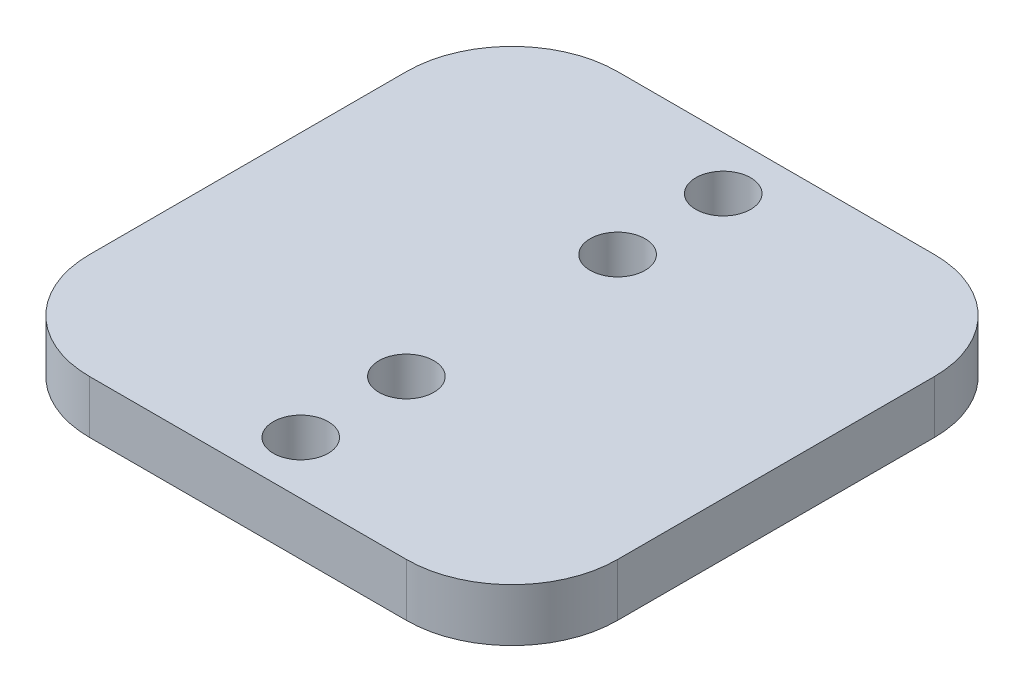
from build123d import *

# Parameters (mm, degrees)
SKETCH1_W           = 50
SKETCH1_H           = 50
BOSS_EXTRUDE1_DEPTH = 5
SKETCH2_R           = 2.6
CUT_EXTRUDE1_DEPTH  = 71.887234394
FILLET1_R           = 10


with BuildPart() as part:
    # Sketch1 → Boss-Extrude1 (new body)
    with BuildSketch(Plane(origin=(0, 0, 0), x_dir=(1, 0, 0), z_dir=(0, 1, 0))):
        with Locations((25, 25)):
            Rectangle(SKETCH1_W, SKETCH1_H)
    extrude(amount=BOSS_EXTRUDE1_DEPTH)

    # Sketch2 → Cut-Extrude1 (cut, through all)
    with BuildSketch(Plane(origin=(0, 5, 0), x_dir=(1, 0, 0), z_dir=(0, 1, 0))):
        with Locations(Location((25, 35, 0), (0, 0, 270))):
            Circle(SKETCH2_R)
        with Locations(Location((25, 45, 0), (0, 0, 270))):
            Circle(SKETCH2_R)
        with Locations(Location((25, 15, 0), (0, 0, 90))):
            Circle(SKETCH2_R)
        with Locations(Location((25, 5, 0), (0, 0, 90))):
            Circle(SKETCH2_R)
    extrude(amount=-CUT_EXTRUDE1_DEPTH, mode=Mode.SUBTRACT)

    # Fillet1
    fillet1_edges = [part.edges().sort_by_distance(p)[0] for p in [
        (0, 2.5, -50),
        (50, 2.5, -50),
        (50, 2.5, 0),
        (0, 2.5, 0),
    ]]
    fillet(fillet1_edges, radius=FILLET1_R)


solid = part.part
